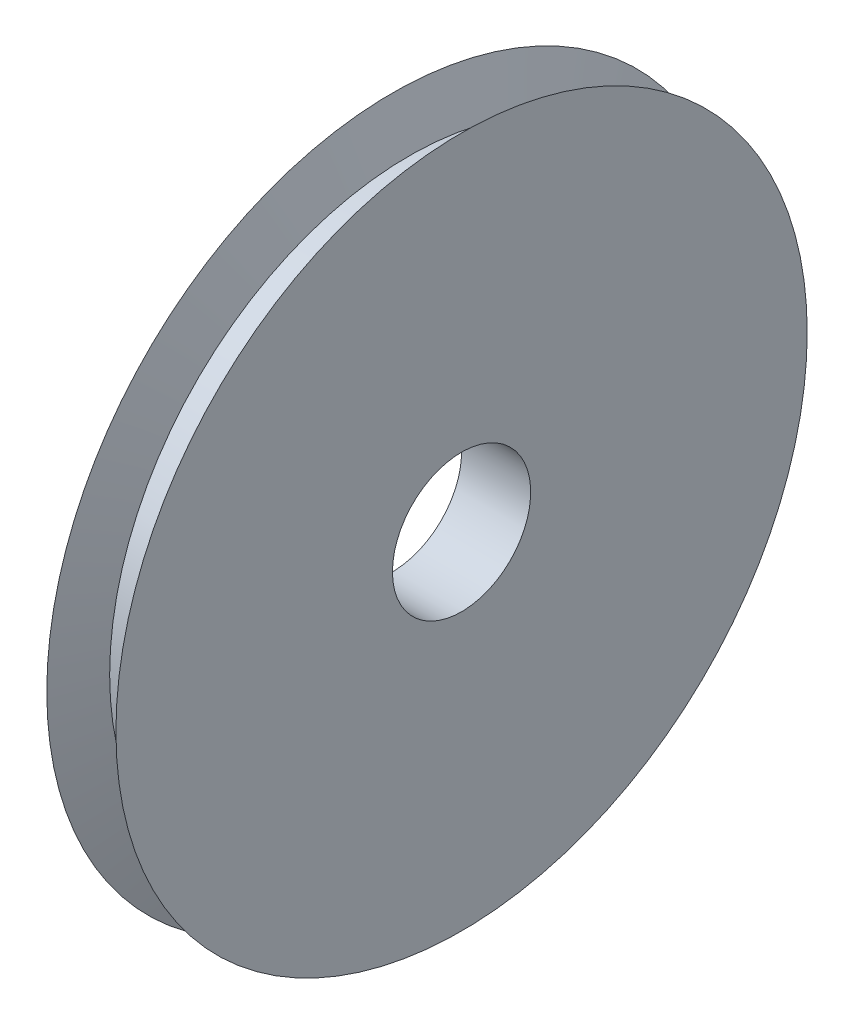
from build123d import *


with BuildPart() as part:
    # Croquis1 → Revolución1 (revolve)
    with BuildSketch(Plane.XY, mode=Mode.PRIVATE) as revoluci_n1_sk:
        Polygon((7.5, 15), (-7.5, 15), (-7.5, 75), (-3.860297657, 65), (3.860297657, 65), (7.5, 75), align=None)
    revolve(revoluci_n1_sk.sketch.rotate(Axis((-41.461285615, 0, 0), (1, 0, 0)), 90), axis=Axis((-41.461285615, 0, 0), (1, 0, 0)))


solid = part.part
